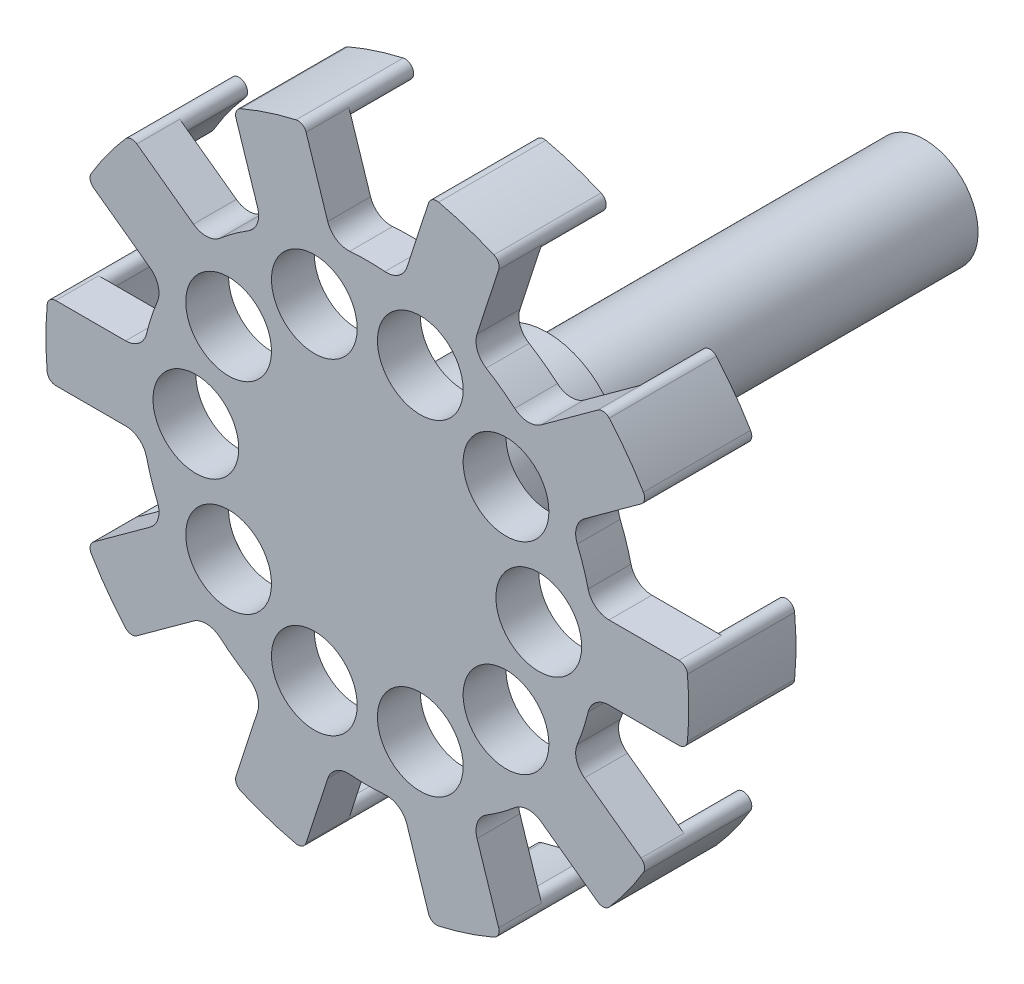
from build123d import *

# Parameters (mm, degrees)
SCHIZZO1_R                   = 53
SCHIZZO1_R_2                 = 10
ESTRUSIONE_ESTRUSIONE1_DEPTH = 10
ESTRUSIONE_ESTRUSIONE2_DEPTH = 10
ESTRUSIONE_ESTRUSIONE3_START = 15
ESTRUSIONE_ESTRUSIONE3_DEPTH = 15
RACCORDO1_R                  = 5
SCHIZZO4_R                   = 17.5
ESTRUSIONE_ESTRUSIONE4_DEPTH = 32
SCHIZZO5_R                   = 12.5
ESTRUSIONE_ESTRUSIONE5_DEPTH = 88


with BuildPart() as part:
    # Schizzo1 → Estrusione-Estrusione1 (new body)
    with BuildSketch(Plane.XY):
        Circle(SCHIZZO1_R)
        with Locations((40, 0)):
            Circle(SCHIZZO1_R_2, mode=Mode.SUBTRACT)
        with Locations((32.360679775, -23.511410092)):
            Circle(SCHIZZO1_R_2, mode=Mode.SUBTRACT)
        with Locations((12.360679775, -38.042260652)):
            Circle(SCHIZZO1_R_2, mode=Mode.SUBTRACT)
        with Locations((-12.360679775, -38.042260652)):
            Circle(SCHIZZO1_R_2, mode=Mode.SUBTRACT)
        with Locations((-32.360679775, -23.511410092)):
            Circle(SCHIZZO1_R_2, mode=Mode.SUBTRACT)
        with Locations((-40, 0)):
            Circle(SCHIZZO1_R_2, mode=Mode.SUBTRACT)
        with Locations((-32.360679775, 23.511410092)):
            Circle(SCHIZZO1_R_2, mode=Mode.SUBTRACT)
        with Locations((-12.360679775, 38.042260652)):
            Circle(SCHIZZO1_R_2, mode=Mode.SUBTRACT)
        with Locations((12.360679775, 38.042260652)):
            Circle(SCHIZZO1_R_2, mode=Mode.SUBTRACT)
        with Locations((32.360679775, 23.511410092)):
            Circle(SCHIZZO1_R_2, mode=Mode.SUBTRACT)
    extrude(amount=ESTRUSIONE_ESTRUSIONE1_DEPTH)

    # Schizzo2 → Estrusione-Estrusione2 (add)
    with BuildSketch(Plane(origin=(0, 0, 0), x_dir=(-1, 0, 0), z_dir=(0, 0, -1))):
        with BuildLine():
            Line((52.297609888, 8.6), (72.70103163, 8.6))
            ThreePointArc((72.70103163, 8.6), (74.049800728, 8.076760616), (74.692840715, 6.780821918))
            ThreePointArc((74.692840715, 6.780821918), (75, 0), (74.692840715, -6.780821918))
            ThreePointArc((74.692840715, -6.780821918), (74.049800728, -8.076760616), (72.70103163, -8.6))
            Line((72.70103163, -8.6), (52.297609888, -8.6))
            ThreePointArc((52.297609888, -8.6), (53, 0), (52.297609888, 8.6))
        make_face()
        with BuildLine():
            Line((47.364608334, -23.782217671), (63.871323267, -35.775048067))
            ThreePointArc((63.871323267, -35.775048067), (64.654947996, -36.991144205), (64.413444619, -38.417550057))
            ThreePointArc((64.413444619, -38.417550057), (60.676274578, -44.083893922), (56.442110375, -49.389150392))
            ThreePointArc((56.442110375, -49.389150392), (55.160146443, -50.059617401), (53.761416927, -49.69014037))
            Line((53.761416927, -49.69014037), (37.254701995, -37.697309974))
            ThreePointArc((37.254701995, -37.697309974), (42.877900702, -31.152618372), (47.364608334, -23.782217671))
        make_face()
        with BuildLine():
            Line((24.339936261, -47.080436519), (30.644940322, -66.485243721))
            ThreePointArc((30.644940322, -66.485243721), (30.56410267, -67.929689223), (29.53030201, -68.941723674))
            ThreePointArc((29.53030201, -68.941723674), (23.176274578, -71.329238722), (16.632412268, -73.132502091))
            ThreePointArc((16.632412268, -73.132502091), (15.20119104, -72.921401803), (14.286768242, -71.800336024))
            Line((14.286768242, -71.800336024), (7.98176418, -52.395528822))
            ThreePointArc((7.98176418, -52.395528822), (16.377900702, -50.405995364), (24.339936261, -47.080436519))
        make_face()
        with BuildLine():
            Line((-7.98176418, -52.395528822), (-14.286768242, -71.800336024))
            ThreePointArc((-14.286768242, -71.800336024), (-15.20119104, -72.921401803), (-16.632412268, -73.132502091))
            ThreePointArc((-16.632412268, -73.132502091), (-23.176274578, -71.329238722), (-29.53030201, -68.941723674))
            ThreePointArc((-29.53030201, -68.941723674), (-30.56410267, -67.929689223), (-30.644940322, -66.485243721))
            Line((-30.644940322, -66.485243721), (-24.339936261, -47.080436519))
            ThreePointArc((-24.339936261, -47.080436519), (-16.377900702, -50.405995364), (-7.98176418, -52.395528822))
        make_face()
        with BuildLine():
            Line((-37.254701995, -37.697309974), (-53.761416927, -49.69014037))
            ThreePointArc((-53.761416927, -49.69014037), (-55.160146443, -50.059617401), (-56.442110375, -49.389150392))
            ThreePointArc((-56.442110375, -49.389150392), (-60.676274578, -44.083893922), (-64.413444619, -38.417550057))
            ThreePointArc((-64.413444619, -38.417550057), (-64.654947996, -36.991144205), (-63.871323267, -35.775048067))
            Line((-63.871323267, -35.775048067), (-47.364608334, -23.782217671))
            ThreePointArc((-47.364608334, -23.782217671), (-42.877900702, -31.152618372), (-37.254701995, -37.697309974))
        make_face()
        with BuildLine():
            Line((-52.297609888, -8.6), (-72.70103163, -8.6))
            ThreePointArc((-72.70103163, -8.6), (-74.049800728, -8.076760616), (-74.692840715, -6.780821918))
            ThreePointArc((-74.692840715, -6.780821918), (-75, 0), (-74.692840715, 6.780821918))
            ThreePointArc((-74.692840715, 6.780821918), (-74.049800728, 8.076760616), (-72.70103163, 8.6))
            Line((-72.70103163, 8.6), (-52.297609888, 8.6))
            ThreePointArc((-52.297609888, 8.6), (-53, 0), (-52.297609888, -8.6))
        make_face()
        with BuildLine():
            Line((-47.364608334, 23.782217671), (-63.871323267, 35.775048067))
            ThreePointArc((-63.871323267, 35.775048067), (-64.654947996, 36.991144205), (-64.413444619, 38.417550057))
            ThreePointArc((-64.413444619, 38.417550057), (-60.676274578, 44.083893922), (-56.442110375, 49.389150392))
            ThreePointArc((-56.442110375, 49.389150392), (-55.160146443, 50.059617401), (-53.761416927, 49.69014037))
            Line((-53.761416927, 49.69014037), (-37.254701995, 37.697309974))
            ThreePointArc((-37.254701995, 37.697309974), (-42.877900702, 31.152618372), (-47.364608334, 23.782217671))
        make_face()
        with BuildLine():
            Line((-24.339936261, 47.080436519), (-30.644940322, 66.485243721))
            ThreePointArc((-30.644940322, 66.485243721), (-30.56410267, 67.929689223), (-29.53030201, 68.941723674))
            ThreePointArc((-29.53030201, 68.941723674), (-23.176274578, 71.329238722), (-16.632412268, 73.132502091))
            ThreePointArc((-16.632412268, 73.132502091), (-15.20119104, 72.921401803), (-14.286768242, 71.800336024))
            Line((-14.286768242, 71.800336024), (-7.98176418, 52.395528822))
            ThreePointArc((-7.98176418, 52.395528822), (-16.377900702, 50.405995364), (-24.339936261, 47.080436519))
        make_face()
        with BuildLine():
            Line((7.98176418, 52.395528822), (14.286768242, 71.800336024))
            ThreePointArc((14.286768242, 71.800336024), (15.201191041, 72.921401803), (16.632412268, 73.132502091))
            ThreePointArc((16.632412268, 73.132502091), (23.176274578, 71.329238722), (29.53030201, 68.941723674))
            ThreePointArc((29.53030201, 68.941723674), (30.56410267, 67.929689223), (30.644940322, 66.485243721))
            Line((30.644940322, 66.485243721), (24.339936261, 47.080436519))
            ThreePointArc((24.339936261, 47.080436519), (16.377900702, 50.405995364), (7.98176418, 52.395528822))
        make_face()
        with BuildLine():
            Line((37.254701995, 37.697309974), (53.761416927, 49.69014037))
            ThreePointArc((53.761416927, 49.69014037), (55.160146443, 50.059617401), (56.442110375, 49.389150392))
            ThreePointArc((56.442110375, 49.389150392), (60.676274578, 44.083893922), (64.413444619, 38.417550057))
            ThreePointArc((64.413444619, 38.417550057), (64.654947996, 36.991144205), (63.871323267, 35.775048067))
            Line((63.871323267, 35.775048067), (47.364608334, 23.782217671))
            ThreePointArc((47.364608334, 23.782217671), (42.877900702, 31.152618372), (37.254701995, 37.697309974))
        make_face()
    extrude(amount=-ESTRUSIONE_ESTRUSIONE2_DEPTH)

    # Schizzo3 → Estrusione-Estrusione3 (add)
    with BuildSketch(Plane(origin=(0, 0, 0), x_dir=(-1, 0, 0), z_dir=(0, 0, -1)).offset(ESTRUSIONE_ESTRUSIONE3_START)):
        with BuildLine():
            ThreePointArc((74.692840715, -6.780821918), (75, 0), (74.692840715, 6.780821918))
            ThreePointArc((74.692840715, 6.780821918), (72.520209712, 8.591809086), (70.709222544, 6.419178082))
            ThreePointArc((70.709222544, 6.419178082), (71, 0), (70.709222544, -6.419178082))
            ThreePointArc((70.709222544, -6.419178082), (72.520209712, -8.591809086), (74.692840715, -6.780821918))
        make_face()
        with BuildLine():
            ThreePointArc((53.431864488, -46.755062371), (57.440206601, -41.732752913), (60.978060906, -36.368614054))
            ThreePointArc((60.978060906, -36.368614054), (63.720220764, -35.675390199), (64.413444619, -38.417550057))
            ThreePointArc((64.413444619, -38.417550057), (60.676274578, -44.083893922), (56.442110375, -49.389150392))
            ThreePointArc((56.442110375, -49.389150392), (53.619943421, -49.577229325), (53.431864488, -46.755062371))
        make_face()
        with BuildLine():
            ThreePointArc((15.745350281, -69.23210198), (21.940206601, -67.525012657), (27.955352569, -65.264831745))
            ThreePointArc((27.955352569, -65.264831745), (30.581273254, -66.31580299), (29.53030201, -68.941723674))
            ThreePointArc((29.53030201, -68.941723674), (23.176274578, -71.329238722), (16.632412268, -73.132502091))
            ThreePointArc((16.632412268, -73.132502091), (14.238681219, -71.625833029), (15.745350281, -69.23210198))
        make_face()
        with BuildLine():
            ThreePointArc((-27.955352569, -65.264831745), (-21.940206601, -67.525012657), (-15.745350281, -69.23210198))
            ThreePointArc((-15.745350281, -69.23210198), (-14.238681219, -71.625833029), (-16.632412268, -73.132502091))
            ThreePointArc((-16.632412268, -73.132502091), (-23.176274578, -71.329238722), (-29.53030201, -68.941723674))
            ThreePointArc((-29.53030201, -68.941723674), (-30.581273254, -66.31580299), (-27.955352569, -65.264831745))
        make_face()
        with BuildLine():
            ThreePointArc((-60.978060906, -36.368614054), (-57.440206601, -41.732752913), (-53.431864488, -46.755062371))
            ThreePointArc((-53.431864488, -46.755062371), (-53.619943421, -49.577229325), (-56.442110375, -49.389150392))
            ThreePointArc((-56.442110375, -49.389150392), (-60.676274578, -44.083893922), (-64.413444619, -38.417550057))
            ThreePointArc((-64.413444619, -38.417550057), (-63.720220764, -35.675390199), (-60.978060906, -36.368614054))
        make_face()
        with BuildLine():
            ThreePointArc((-70.709222544, 6.419178082), (-71, 0), (-70.709222544, -6.419178082))
            ThreePointArc((-70.709222544, -6.419178082), (-72.520209712, -8.591809086), (-74.692840715, -6.780821918))
            ThreePointArc((-74.692840715, -6.780821918), (-75, 0), (-74.692840715, 6.780821918))
            ThreePointArc((-74.692840715, 6.780821918), (-72.520209712, 8.591809086), (-70.709222544, 6.419178082))
        make_face()
        with BuildLine():
            ThreePointArc((-53.431864488, 46.755062371), (-57.440206601, 41.732752913), (-60.978060906, 36.368614054))
            ThreePointArc((-60.978060906, 36.368614054), (-63.720220764, 35.675390199), (-64.413444619, 38.417550057))
            ThreePointArc((-64.413444619, 38.417550057), (-60.676274578, 44.083893922), (-56.442110375, 49.389150392))
            ThreePointArc((-56.442110375, 49.389150392), (-53.619943421, 49.577229325), (-53.431864488, 46.755062371))
        make_face()
        with BuildLine():
            ThreePointArc((-15.745350281, 69.23210198), (-21.940206601, 67.525012657), (-27.955352569, 65.264831745))
            ThreePointArc((-27.955352569, 65.264831745), (-30.581273254, 66.31580299), (-29.53030201, 68.941723674))
            ThreePointArc((-29.53030201, 68.941723674), (-23.176274578, 71.329238722), (-16.632412268, 73.132502091))
            ThreePointArc((-16.632412268, 73.132502091), (-14.238681219, 71.625833029), (-15.745350281, 69.23210198))
        make_face()
        with BuildLine():
            ThreePointArc((27.955352569, 65.264831745), (21.940206601, 67.525012657), (15.745350281, 69.23210198))
            ThreePointArc((15.745350281, 69.23210198), (14.238681219, 71.625833029), (16.632412268, 73.132502091))
            ThreePointArc((16.632412268, 73.132502091), (23.176274578, 71.329238722), (29.53030201, 68.941723674))
            ThreePointArc((29.53030201, 68.941723674), (30.581273254, 66.31580299), (27.955352569, 65.264831745))
        make_face()
        with BuildLine():
            ThreePointArc((60.978060906, 36.368614054), (57.440206601, 41.732752913), (53.431864488, 46.755062371))
            ThreePointArc((53.431864488, 46.755062371), (53.619943421, 49.577229325), (56.442110375, 49.389150392))
            ThreePointArc((56.442110375, 49.389150392), (60.676274578, 44.083893922), (64.413444619, 38.417550057))
            ThreePointArc((64.413444619, 38.417550057), (63.720220764, 35.675390199), (60.978060906, 36.368614054))
        make_face()
    extrude(amount=-ESTRUSIONE_ESTRUSIONE3_DEPTH)

    # Raccordo1
    raccordo1_edges = [part.edges().sort_by_distance(p)[0] for p in [
        (47.364608334, -23.782217671, 5),
        (37.254701995, -37.697309974, 5),
        (52.297609888, 8.6, 5),
        (52.297609888, -8.6, 5),
        (37.254701995, 37.697309974, 5),
        (47.364608334, 23.782217671, 5),
        (7.98176418, 52.395528822, 5),
        (24.339936261, 47.080436519, 5),
        (-24.339936261, 47.080436519, 5),
        (-7.98176418, 52.395528822, 5),
        (-47.364608334, 23.782217671, 5),
        (-37.254701995, 37.697309974, 5),
        (-52.297609888, -8.6, 5),
        (-52.297609888, 8.6, 5),
        (-37.254701995, -37.697309974, 5),
        (-47.364608334, -23.782217671, 5),
        (-7.98176418, -52.395528822, 5),
        (-24.339936261, -47.080436519, 5),
        (24.339936261, -47.080436519, 5),
        (7.98176418, -52.395528822, 5),
    ]]
    fillet(raccordo1_edges, radius=RACCORDO1_R)

    # Schizzo4 → Estrusione-Estrusione4 (add)
    with BuildSketch(Plane(origin=(0, 0, 0), x_dir=(-1, 0, 0), z_dir=(0, 0, -1))):
        with Locations(Location((0, 0, 0), (0, 0, 180))):
            Circle(SCHIZZO4_R)
    extrude(amount=ESTRUSIONE_ESTRUSIONE4_DEPTH)

    # Schizzo5 → Estrusione-Estrusione5 (add)
    with BuildSketch(Plane(origin=(0, 0, -32), x_dir=(-1, 0, 0), z_dir=(0, 0, -1))):
        Circle(SCHIZZO5_R)
    extrude(amount=ESTRUSIONE_ESTRUSIONE5_DEPTH)


solid = part.part
